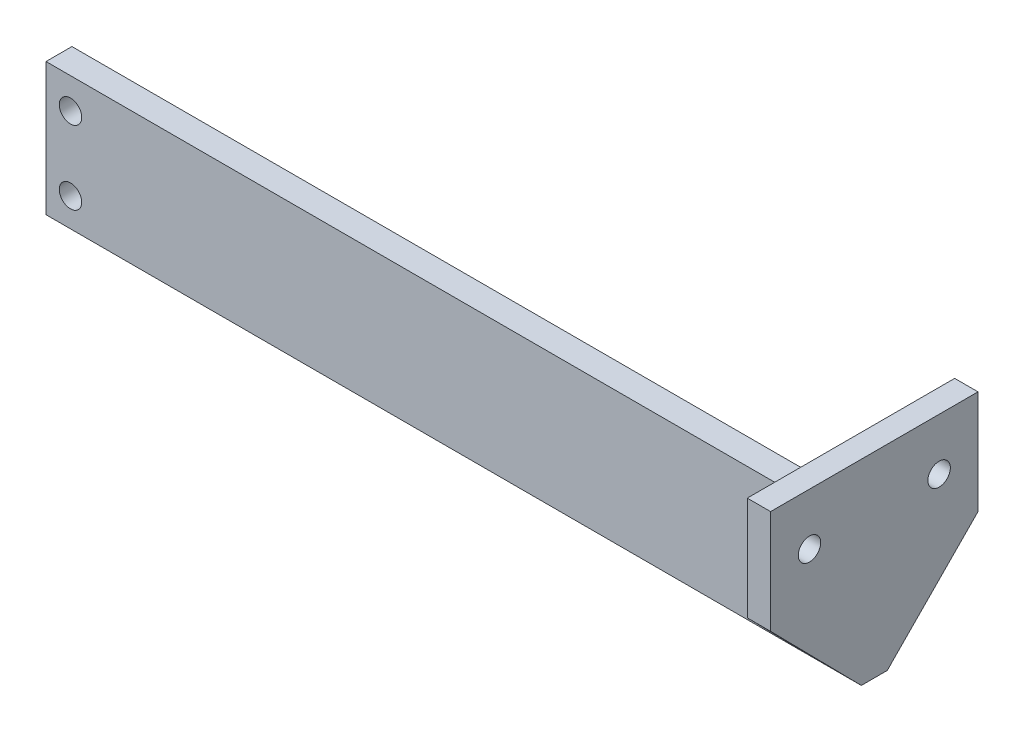
from build123d import *

# Parameters (mm, degrees)
SKETCH1_W           = 193.9764
SKETCH1_H           = 32.5
BOSS_EXTRUDE1_DEPTH = 6.35
SKETCH2_R           = 2.75
CUT_EXTRUDE1_DEPTH  = 197.782662491
BOSS_EXTRUDE2_DEPTH = 5.715
SKETCH4_R           = 2.75
CUT_EXTRUDE2_DEPTH  = 208.356239103


with BuildPart() as part:
    # Sketch1 → Boss-Extrude1 (new body)
    with BuildSketch(Plane.XY):
        with Locations((96.9882, 16.25)):
            Rectangle(SKETCH1_W, SKETCH1_H)
    extrude(amount=BOSS_EXTRUDE1_DEPTH)

    # Sketch2 → Cut-Extrude1 (cut, through all)
    with BuildSketch(Plane.XY.offset(6.35)):
        with Locations((6, 25)):
            Circle(SKETCH2_R)
        with Locations((6, 7)):
            Circle(SKETCH2_R)
    extrude(amount=-CUT_EXTRUDE1_DEPTH, mode=Mode.SUBTRACT)

    # Sketch3 → Boss-Extrude2 (add)
    with BuildSketch(Plane(origin=(193.9764, 0, 0), x_dir=(0, 0, -1), z_dir=(1, 0, 0))):
        Polygon((-28.575, 39.500902), (-28.575, 22.594), (22.225, 22.594), (22.225, 39.500902), (-3.175, 39.500902), align=None)
        Polygon((22.225, 22.594), (-28.575, 22.594), (-6.35, 0), (0, 0), align=None)
        Polygon((-28.575, 47.994), (-28.575, 39.500902), (-3.175, 39.500902), (22.225, 39.500902), (22.225, 47.994), align=None)
    extrude(amount=BOSS_EXTRUDE2_DEPTH)

    # Sketch4 → Cut-Extrude2 (cut, through all)
    with BuildSketch(Plane(origin=(199.6914, 0, 0), x_dir=(0, 0, -1), z_dir=(1, 0, 0))):
        with Locations((-19.05, 35.294)):
            Circle(SKETCH4_R)
        with Locations((12.7, 35.294)):
            Circle(SKETCH4_R)
    extrude(amount=-CUT_EXTRUDE2_DEPTH, mode=Mode.SUBTRACT)


solid = part.part
